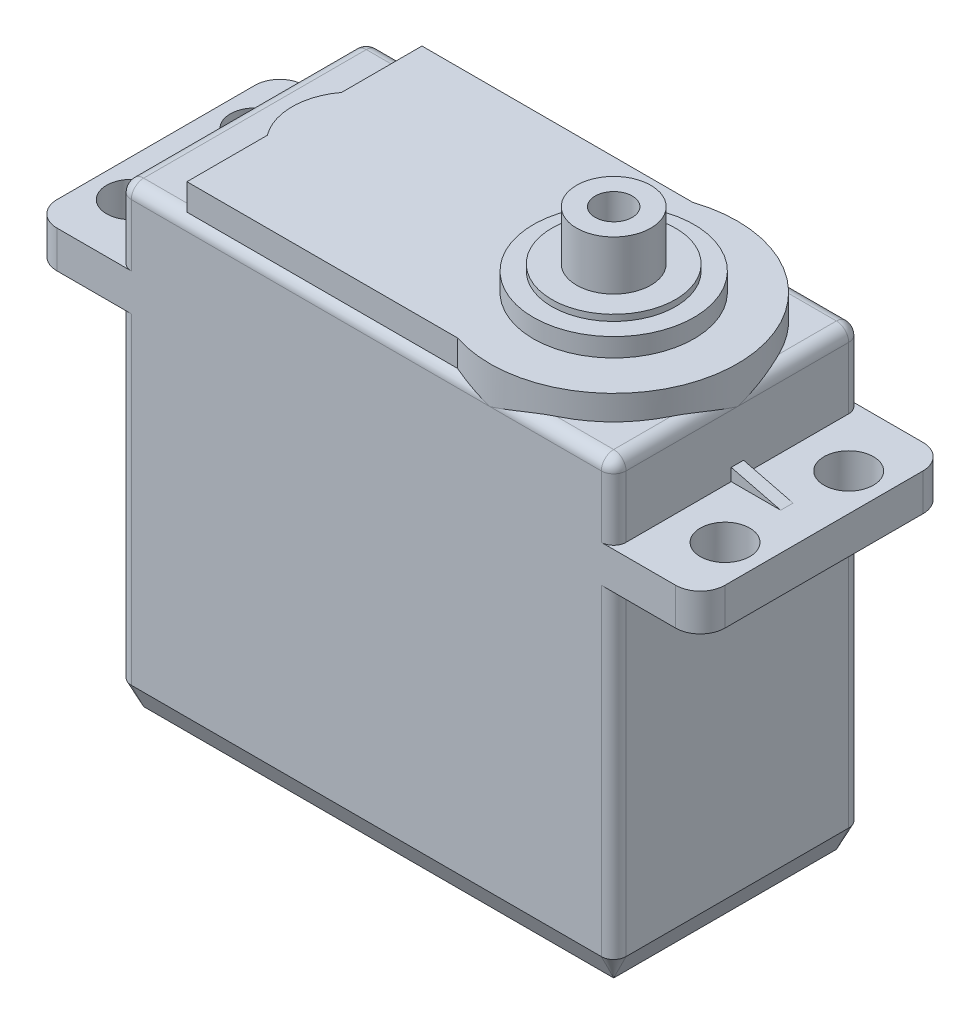
from build123d import *

# Parameters (mm, degrees)
SKETCH_1_W          = 54
SKETCH_1_H          = 20
EXTRUDE_1_DEPTH     = 37
SKETCH_2_W          = 67.922695334
SKETCH_2_H          = 39.407561178
SKETCH_2_W_2        = 40
SKETCH_2_H_2        = 20
CUT_EXTRUDE_1_DEPTH = 28
SKETCH_3_W          = 67.922695334
SKETCH_3_H          = 33.385731604
SKETCH_3_W_2        = 40
SKETCH_3_H_2        = 20
CUT_EXTRUDE_2_DEPTH = 6
FILLET_1_R          = 1
FILLET_2_R          = 2
CHAMFER_1_SIZE      = 1
CHAMFER_1_SIZE2     = 2
SKETCH_4_R          = 2
CUT_EXTRUDE_3_DEPTH = 30
RIB_1_REACH         = 48.883
SKETCH_5_WALL_W     = 99.888770984
SKETCH_5_WALL_H     = 1
EXTRUDE_START       = -1
EXTRUDE_4_DEPTH     = 3
SKETCH_9_R          = 6.5
EXTRUDE_5_DEPTH     = 2
CUT_EXTRUDE_START   = -0.5
SKETCH_10_R         = 6.5
SKETCH_10_R_2       = 5
CUT_EXTRUDE_4_DEPTH = 0.5
SKETCH_11_R         = 3
EXTRUDE_6_DEPTH     = 4
SKETCH_14_R         = 1.5
CUT_EXTRUDE_5_DEPTH = 4


with BuildPart() as part:
    # 草图1 → 凸台-拉伸1 (new body)
    with BuildSketch(Plane(origin=(0, 0, 0), x_dir=(1, 0, 0), z_dir=(0, 1, 0))):
        Rectangle(SKETCH_1_W, SKETCH_1_H)
    extrude(amount=EXTRUDE_1_DEPTH)

    # 草图2 → 切除-拉伸1 (cut)
    with BuildSketch(Plane.XZ):
        Rectangle(SKETCH_2_W, SKETCH_2_H)
        Rectangle(SKETCH_2_W_2, SKETCH_2_H_2, mode=Mode.SUBTRACT)
    extrude(amount=-CUT_EXTRUDE_1_DEPTH, mode=Mode.SUBTRACT)

    # 草图3 → 切除-拉伸2 (cut)
    with BuildSketch(Plane(origin=(0, 37, 0), x_dir=(1, 0, 0), z_dir=(0, 1, 0))):
        Rectangle(SKETCH_3_W, SKETCH_3_H)
        Rectangle(SKETCH_3_W_2, SKETCH_3_H_2, mode=Mode.SUBTRACT)
    extrude(amount=-CUT_EXTRUDE_2_DEPTH, mode=Mode.SUBTRACT)

    # 圆角1
    fillet_1_edges = [part.edges().sort_by_distance(p)[0] for p in [
        (20, 14, -10),
        (-20, 14, -10),
        (-20, 14, 10),
        (20, 14, 10),
        (0, 37, -10),
        (0, 37, 10),
        (20, 37, 0),
        (20, 34, 10),
        (-20, 34, 10),
        (-20, 37, 0),
        (-20, 34, -10),
        (20, 34, -10),
    ]]
    fillet(fillet_1_edges, radius=FILLET_1_R)

    # 圆角2
    fillet_2_edges = [part.edges().sort_by_distance(p)[0] for p in [
        (27, 29.5, 10),
        (-27, 29.5, 10),
        (-27, 29.5, -10),
        (27, 29.5, -10),
    ]]
    fillet(fillet_2_edges, radius=FILLET_2_R)

    # 倒角1
    chamfer_1_edges = [part.edges().sort_by_distance(p)[0] for p in [
        (0, 0, -10),
        (0, 0, 10),
        (-20, 0, 0),
        (20, 0, 0),
        (-19.707106781, 0, 9.707106781),
        (19.707106781, 0, 9.707106781),
        (19.707106781, 0, -9.707106781),
        (-19.707106781, 0, -9.707106781),
    ]]
    chamfer_1_side = [part.faces().sort_by_distance(p)[0] for p in [
        (0, 0, 0),
    ]]
    chamfer(chamfer_1_edges, length=CHAMFER_1_SIZE, length2=CHAMFER_1_SIZE2, reference=chamfer_1_side[0])

    # 草图4 → 切除-拉伸3 (cut)
    with BuildSketch(Plane(origin=(0, 37, 0), x_dir=(1, 0, 0), z_dir=(0, 1, 0))):
        with Locations(Location((-24, 5, 0), (0, 0, 270))):
            Circle(SKETCH_4_R)
        with Locations(Location((-24, -5, 0), (0, 0, 270))):
            Circle(SKETCH_4_R)
        with Locations(Location((24, -5, 0), (0, 0, 270))):
            Circle(SKETCH_4_R)
        with Locations(Location((24, 5, 0), (0, 0, 270))):
            Circle(SKETCH_4_R)
    extrude(amount=-CUT_EXTRUDE_3_DEPTH, mode=Mode.SUBTRACT)

    # 草图5 wall → 筋1 (add, up to next)
    with BuildSketch(Plane(origin=(-22, 31.5, 0), x_dir=(-0.970142500145, -0.242535625036, 0), z_dir=(0.242535625036, -0.970142500145, 0)), mode=Mode.PRIVATE) as rib_1_sk1:
        Rectangle(SKETCH_5_WALL_W, SKETCH_5_WALL_H)
    rib_1_tool1 = extrude(rib_1_sk1.sketch, amount=RIB_1_REACH, mode=Mode.PRIVATE) - part.part
    rib_1 = rib_1_tool1.solids().sort_by_distance((-22, 31.5, 0))[0]
    add(rib_1)

    # 镜向1: 筋1 across plane
    add(rib_1.mirror(Plane(origin=(0, 0, 0), x_dir=(0, 0, 1), z_dir=(1, 0, 0))))

    # 草图8 → 凸台-拉伸4 (add)
    with BuildSketch(Plane(origin=(0, 37, 0), x_dir=(1, 0, 0), z_dir=(0, 1, 0)).offset(EXTRUDE_START)):
        with BuildLine():
            Line((-15, 9.5), (6.877501001, 9.5))
            ThreePointArc((6.877501001, 9.5), (20, 0), (6.877501001, -9.5))
            Line((6.877501001, -9.5), (-15, -9.5))
            Line((-15, -9.5), (-15, -3))
            ThreePointArc((-15, -3), (-16, 0), (-15, 3))
            Line((-15, 3), (-15, 9.5))
        make_face()
    extrude(amount=EXTRUDE_4_DEPTH)

    # 草图9 → 凸台-拉伸5 (add)
    with BuildSketch(Plane(origin=(0, 39, 0), x_dir=(1, 0, 0), z_dir=(0, 1, 0))):
        with Locations(Location((10, 0, 0), (0, 0, 270))):
            Circle(SKETCH_9_R)
    extrude(amount=EXTRUDE_5_DEPTH)

    # 草图10 → 切除-拉伸4 (cut)
    with BuildSketch(Plane(origin=(0, 41, 0), x_dir=(1, 0, 0), z_dir=(0, 1, 0)).offset(CUT_EXTRUDE_START)):
        with Locations(Location((10, 0, 0), (0, 0, 270))):
            Circle(SKETCH_10_R)
        with Locations(Location((10, 0, 0), (0, 0, 270))):
            Circle(SKETCH_10_R_2, mode=Mode.SUBTRACT)
    extrude(amount=CUT_EXTRUDE_4_DEPTH, mode=Mode.SUBTRACT)

    # 草图11 → 凸台-拉伸6 (add)
    with BuildSketch(Plane(origin=(0, 41, 0), x_dir=(1, 0, 0), z_dir=(0, 1, 0))):
        with Locations(Location((10, 0, 0), (0, 0, 270))):
            Circle(SKETCH_11_R)
    extrude(amount=EXTRUDE_6_DEPTH)

    # 草图14 → 切除-拉伸5 (cut)
    with BuildSketch(Plane(origin=(0, 45, 0), x_dir=(1, 0, 0), z_dir=(0, 1, 0))):
        with Locations(Location((10, 0, 0), (0, 0, 270))):
            Circle(SKETCH_14_R)
    extrude(amount=-CUT_EXTRUDE_5_DEPTH, mode=Mode.SUBTRACT)


solid = part.part
